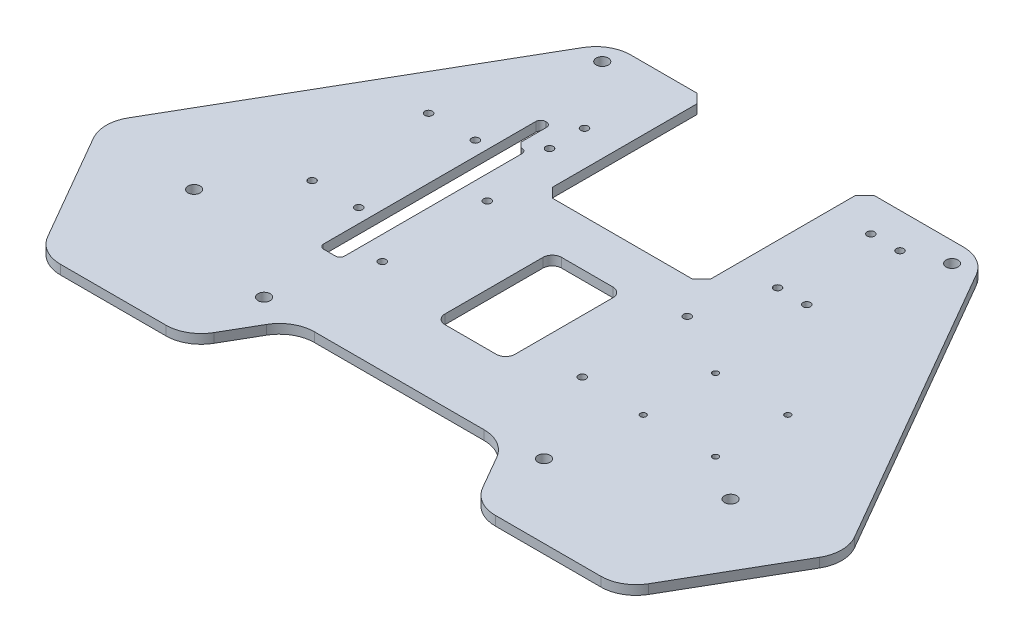
from build123d import *

# Parameters (mm, degrees)
EXTRUDE_1_DEPTH             = 4
SKETCH_34_R                 = 2.6
CUT_EXTRUDE_2_DEPTH         = 209.459490918
CUT_EXTRUDE_3_DEPTH         = 212.697897958
FILLET_2_R                  = 15
SKETCH_37_R                 = 1.6
CUT_EXTRUDE_5_DEPTH         = 210.949570549
PATTERN_LINEAR_1_COUNT      = 2
PATTERN_LINEAR_1_PITCH      = 85.74
PATTERN_LINEAR_1_COUNT_DIR2 = 2
PATTERN_LINEAR_1_PITCH_DIR2 = 45
SKETCH_38_R                 = 1.6
CUT_EXTRUDE_6_DEPTH         = 210.949570549
PATTERN_LINEAR_2_COUNT      = 2
PATTERN_LINEAR_2_PITCH      = 20
PATTERN_LINEAR_2_COUNT_DIR2 = 2
PATTERN_LINEAR_2_PITCH_DIR2 = 50
SKETCH_39_W                 = 68
SKETCH_39_H                 = 70
CUT_EXTRUDE_7_DEPTH         = 210.949570549
CHAMFER_1_SIZE              = 4
CUT_EXTRUDE_9_REACH         = 211.95
SKETCH_41_R                 = 1.6
SKETCH_42_R                 = 1.6
CUT_EXTRUDE_10_DEPTH        = 210.949570549
CUT_EXTRUDE_11_REACH        = 211.95
SKETCH_43_W                 = 30
SKETCH_43_H                 = 50
FILLET_3_R                  = 4
CUT_EXTRUDE_12_REACH        = 211.95
SKETCH_44_W                 = 9
SKETCH_44_H                 = 80
M3X0_5_1_D                  = 2.5
CUT_EXTRUDE_13_REACH        = 211.95
SKETCH_48_W                 = 4.5
SKETCH_48_H                 = 15
CHAMFER_2_SIZE              = 2
FILLET_8_R                  = 2


with BuildPart() as part:
    # 草圖1 → 填料-伸長1 (new body)
    with BuildSketch(Plane(origin=(0, 0, 0), x_dir=(1, 0, 0), z_dir=(0, 1, 0))):
        Polygon((124.529946162, -61.435935394), (-124.529946162, -61.435935394), (-160, 0), (-80, 138.564064606), (80, 138.564064606), (160, 0), align=None)
    extrude(amount=EXTRUDE_1_DEPTH)

    # 草圖34 → 除料-伸長2 (cut, through all)
    with BuildSketch(Plane(origin=(0, 4, -5), x_dir=(1, 0, 0), z_dir=(0, -1, 0))):
        with Locations(Location((-60, 35, 0), (0, 0, 270))):
            Circle(SKETCH_34_R)
        with Locations(Location((-115, 10, 0), (0, 0, 270))):
            Circle(SKETCH_34_R)
        with Locations(Location((-75, -125, 0), (0, 0, 270))):
            Circle(SKETCH_34_R)
    cut_extrude_2 = extrude(amount=CUT_EXTRUDE_2_DEPTH, mode=Mode.SUBTRACT)

    # 鏡射1: 除料-伸長2 across plane
    add(cut_extrude_2.mirror(Plane(origin=(0, 0, 0), x_dir=(0, 0, 1), z_dir=(1, 0, 0))), mode=Mode.SUBTRACT)

    # 草圖35 → 除料-伸長3 (cut, through all)
    with BuildSketch(Plane(origin=(0, 4, 0), x_dir=(1, 0, 0), z_dir=(0, 1, 0))):
        Polygon((45, -32.057713659), (-45, -32.057713659), (-90, -110), (-45, -187.942286341), (45, -187.942286341), (90, -110), align=None)
    extrude(amount=-CUT_EXTRUDE_3_DEPTH, mode=Mode.SUBTRACT)

    # 圓角2
    fillet_2_edges = [part.edges().sort_by_distance(p)[0] for p in [
        (160, 2, 0),
        (124.529946162, 2, 61.435935394),
        (-124.529946162, 2, 61.435935394),
        (-160, 2, 0),
        (-80, 2, -138.564064606),
        (80, 2, -138.564064606),
        (61.961524227, 2, 61.435935394),
        (45, 2, 32.057713659),
        (-61.961524227, 2, 61.435935394),
        (-45, 2, 32.057713659),
    ]]
    fillet(fillet_2_edges, radius=FILLET_2_R)

    # 草圖37 → 除料-伸長5 (cut, through all)
    with BuildSketch(Plane(origin=(0, 4, 0), x_dir=(1, 0, 0), z_dir=(0, 1, 0))):
        with Locations(Location((37.87, 8.564064606, 0), (0, 0, 270))):
            Circle(SKETCH_37_R)
    cut_extrude_5 = extrude(amount=-CUT_EXTRUDE_5_DEPTH, mode=Mode.SUBTRACT)

    # 直線複製排列1: Cut-Extrude 5 2 × 2
    with Locations(*[(-i * PATTERN_LINEAR_1_PITCH, 0, -j * PATTERN_LINEAR_1_PITCH_DIR2) for i in range(PATTERN_LINEAR_1_COUNT) for j in range(PATTERN_LINEAR_1_COUNT_DIR2) if (i, j) != (0, 0)]):
        add(cut_extrude_5, mode=Mode.SUBTRACT)

    # 草圖38 → 除料-伸長6 (cut, through all)
    with BuildSketch(Plane(origin=(0, 4, 0), x_dir=(1, 0, 0), z_dir=(0, 1, 0))):
        with Locations(Location((-73, 73.564064606, 0), (0, 0, 270))):
            Circle(SKETCH_38_R)
    cut_extrude_6 = extrude(amount=-CUT_EXTRUDE_6_DEPTH, mode=Mode.SUBTRACT)

    # 直線複製排列2: Cut-Extrude 6 2 × 2
    with Locations(*[(-i * PATTERN_LINEAR_2_PITCH, 0, j * PATTERN_LINEAR_2_PITCH_DIR2) for i in range(PATTERN_LINEAR_2_COUNT) for j in range(PATTERN_LINEAR_2_COUNT_DIR2) if (i, j) != (0, 0)]):
        add(cut_extrude_6, mode=Mode.SUBTRACT)

    # 草圖39 → 除料-伸長7 (cut, through all)
    with BuildSketch(Plane(origin=(0, 4, 0), x_dir=(1, 0, 0), z_dir=(0, 1, 0))):
        with Locations((-5, 103.564064606)):
            Rectangle(SKETCH_39_W, SKETCH_39_H)
    extrude(amount=-CUT_EXTRUDE_7_DEPTH, mode=Mode.SUBTRACT)

    # 導角1
    chamfer_1_edges = [part.edges().sort_by_distance(p)[0] for p in [
        (29, 2, -138.564064606),
        (29, 2, -68.564064606),
        (-39, 2, -68.564064606),
        (-39, 2, -138.564064606),
    ]]
    chamfer(chamfer_1_edges, length=CHAMFER_1_SIZE)

    # 草圖41 → 除料-伸長9 (cut, up to next)
    with BuildSketch(Plane(origin=(0, 4, 0), x_dir=(1, 0, 0), z_dir=(0, 1, 0)), mode=Mode.PRIVATE) as cut_extrude_9_sk1:
        with Locations(Location((59.1, 123.564064606, 0), (0, 0, 270))):
            Circle(SKETCH_41_R)
    cut_extrude_9_tool1 = extrude(cut_extrude_9_sk1.sketch, amount=-CUT_EXTRUDE_9_REACH, mode=Mode.PRIVATE) & part.part
    # 草圖41 → 除料-伸長9 (cut, up to next)
    with BuildSketch(Plane(origin=(0, 4, 0), x_dir=(1, 0, 0), z_dir=(0, 1, 0)), mode=Mode.PRIVATE) as cut_extrude_9_sk2:
        with Locations(Location((46.6, 123.564064606, 0), (0, 0, 270))):
            Circle(SKETCH_41_R)
    cut_extrude_9_tool2 = extrude(cut_extrude_9_sk2.sketch, amount=-CUT_EXTRUDE_9_REACH, mode=Mode.PRIVATE) & part.part
    # 草圖41 → 除料-伸長9 (cut, up to next)
    with BuildSketch(Plane(origin=(0, 4, 0), x_dir=(1, 0, 0), z_dir=(0, 1, 0)), mode=Mode.PRIVATE) as cut_extrude_9_sk3:
        with Locations(Location((46.6, 83.564064606, 0), (0, 0, 270))):
            Circle(SKETCH_41_R)
    cut_extrude_9_tool3 = extrude(cut_extrude_9_sk3.sketch, amount=-CUT_EXTRUDE_9_REACH, mode=Mode.PRIVATE) & part.part
    # 草圖41 → 除料-伸長9 (cut, up to next)
    with BuildSketch(Plane(origin=(0, 4, 0), x_dir=(1, 0, 0), z_dir=(0, 1, 0)), mode=Mode.PRIVATE) as cut_extrude_9_sk4:
        with Locations(Location((59.1, 83.564064606, 0), (0, 0, 270))):
            Circle(SKETCH_41_R)
    cut_extrude_9_tool4 = extrude(cut_extrude_9_sk4.sketch, amount=-CUT_EXTRUDE_9_REACH, mode=Mode.PRIVATE) & part.part
    add(cut_extrude_9_tool1.solids().sort_by_distance((59.1, 4, -123.564065))[0], mode=Mode.SUBTRACT)
    add(cut_extrude_9_tool2.solids().sort_by_distance((46.6, 4, -123.564065))[0], mode=Mode.SUBTRACT)
    add(cut_extrude_9_tool3.solids().sort_by_distance((46.6, 4, -83.564065))[0], mode=Mode.SUBTRACT)
    add(cut_extrude_9_tool4.solids().sort_by_distance((59.1, 4, -83.564065))[0], mode=Mode.SUBTRACT)

    # 草圖42 → 除料-伸長10 (cut, through all)
    with BuildSketch(Plane(origin=(0, 4, 0), x_dir=(1, 0, 0), z_dir=(0, 1, 0))):
        with Locations(Location((-54, 101.384064606, 0), (0, 0, 270))):
            Circle(SKETCH_42_R)
        with Locations(Location((-54, 86.384064606, 0), (0, 0, 270))):
            Circle(SKETCH_42_R)
    extrude(amount=-CUT_EXTRUDE_10_DEPTH, mode=Mode.SUBTRACT)

    # 草圖43 → 除料-伸長11 (cut, up to next)
    with BuildSketch(Plane(origin=(0, 4, 0), x_dir=(1, 0, 0), z_dir=(0, 1, 0)), mode=Mode.PRIVATE) as cut_extrude_11_sk1:
        with Locations((0, 23.564064606)):
            Rectangle(SKETCH_43_W, SKETCH_43_H)
    cut_extrude_11_tool1 = extrude(cut_extrude_11_sk1.sketch, amount=-CUT_EXTRUDE_11_REACH, mode=Mode.PRIVATE) & part.part
    add(cut_extrude_11_tool1.solids().sort_by_distance((0, 4, -23.564065))[0], mode=Mode.SUBTRACT)

    # 圓角3
    fillet_3_edges = [part.edges().sort_by_distance(p)[0] for p in [
        (15, 2, -48.564064606),
        (15, 2, 1.435935394),
        (-15, 2, 1.435935394),
        (-15, 2, -48.564064606),
    ]]
    fillet(fillet_3_edges, radius=FILLET_3_R)

    # 草圖44 → 除料-伸長12 (cut, up to next)
    with BuildSketch(Plane(origin=(0, 4, 0), x_dir=(1, 0, 0), z_dir=(0, 1, 0)), mode=Mode.PRIVATE) as cut_extrude_12_sk1:
        with Locations((-62.5, 40.564064606)):
            Rectangle(SKETCH_44_W, SKETCH_44_H)
    cut_extrude_12_tool1 = extrude(cut_extrude_12_sk1.sketch, amount=-CUT_EXTRUDE_12_REACH, mode=Mode.PRIVATE) & part.part
    add(cut_extrude_12_tool1.solids().sort_by_distance((-62.5, 4, -40.564065))[0], mode=Mode.SUBTRACT)

    # M3x0.5 螺紋孔1 (through all)
    with Locations(Plane(origin=(0, 4, 0), x_dir=(1, 0, 0), z_dir=(0, 1, 0))):
        with Locations((96, 7.564064606), (65, 7.564064606), (65, 38.564064606), (96, 38.564064606)):
            Hole(M3X0_5_1_D / 2)

    # 草圖48 → 除料-伸長13 (cut, up to next)
    with BuildSketch(Plane(origin=(0, 4, 0), x_dir=(1, 0, 0), z_dir=(0, 1, 0)), mode=Mode.PRIVATE) as cut_extrude_13_sk1:
        with Locations((-64.75, 88.064064606)):
            Rectangle(SKETCH_48_W, SKETCH_48_H)
    cut_extrude_13_tool1 = extrude(cut_extrude_13_sk1.sketch, amount=-CUT_EXTRUDE_13_REACH, mode=Mode.PRIVATE) & part.part
    add(cut_extrude_13_tool1.solids().sort_by_distance((-64.75, 4, -88.064065))[0], mode=Mode.SUBTRACT)

    # 導角2
    chamfer_2_edges = [part.edges().sort_by_distance(p)[0] for p in [
        (-62.5, 2, -80.564064606),
    ]]
    chamfer(chamfer_2_edges, length=CHAMFER_2_SIZE)

    # 圓角8
    fillet_8_edges = [part.edges().sort_by_distance(p)[0] for p in [
        (-58, 2, -80.564064606),
        (-58, 2, -0.564064606),
        (-67, 2, -0.564064606),
        (-62.5, 2, -95.564064606),
        (-67, 2, -95.564064606),
    ]]
    fillet(fillet_8_edges, radius=FILLET_8_R)


solid = part.part
